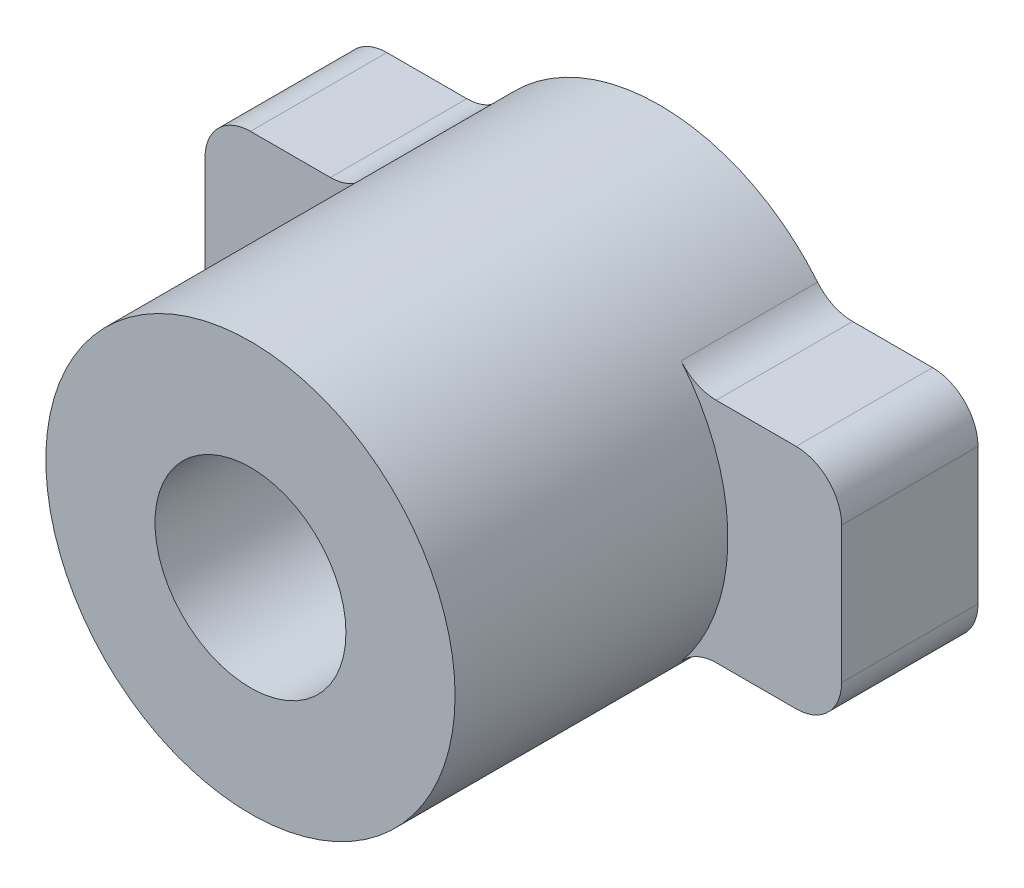
from build123d import *

# Parameters (mm, degrees)
SKETCH_1_R         = 4.5
EXTRUDE_1_DEPTH    = 9
SKETCH_2_W         = 14
SKETCH_2_H         = 5
EXTRUDE_2_DEPTH    = 3
HOLE_WIZARD_M5_1_D = 4.2
FILLET_1_R         = 1


with BuildPart() as part:
    # 草图1 → 凸台-拉伸1 (new body)
    with BuildSketch(Plane.XY):
        Circle(SKETCH_1_R)
    extrude(amount=EXTRUDE_1_DEPTH)

    # 草图2 → 凸台-拉伸2 (add)
    with BuildSketch(Plane(origin=(0, 0, 0), x_dir=(-1, 0, 0), z_dir=(0, 0, -1))):
        Rectangle(SKETCH_2_W, SKETCH_2_H)
    extrude(amount=-EXTRUDE_2_DEPTH)

    # M5 螺纹孔1 (through all)
    with Locations(Plane.XY.offset(9)):
        with Locations((0, 0)):
            Hole(HOLE_WIZARD_M5_1_D / 2)

    # 圆角1
    fillet_1_edges = [part.edges().sort_by_distance(p)[0] for p in [
        (-7, -2.5, 1.5),
        (7, 2.5, 1.5),
        (-7, 2.5, 1.5),
        (-3.741657387, -2.5, 1.5),
        (3.741657387, -2.5, 1.5),
        (7, -2.5, 1.5),
        (3.741657387, 2.5, 1.5),
        (-3.741657387, 2.5, 1.5),
    ]]
    fillet(fillet_1_edges, radius=FILLET_1_R)


solid = part.part
